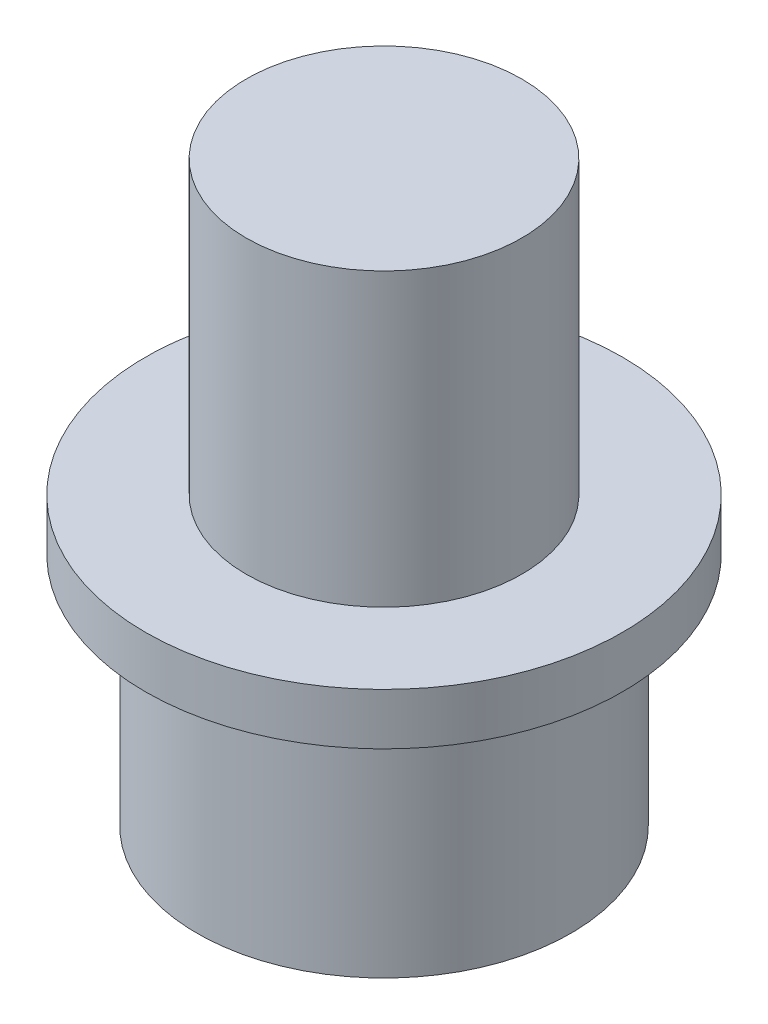
from build123d import *

# Parameters (mm, degrees)
SKETCH_2_R          = 2.3
CUT_EXTRUDE_1_DEPTH = 3.92
CUT_EXTRUDE_START   = -0.62
SKETCH_3_R          = 3.98
SKETCH_3_R_2        = 2.3
CUT_EXTRUDE_2_DEPTH = 0.62


with BuildPart() as part:
    # 草图1 → 旋转1 (revolve)
    with BuildSketch(Plane.XY, mode=Mode.PRIVATE) as revolve_1_sk:
        Polygon((0, 0), (0, 9.64), (2.3, 9.64), (2.3, 5.4), (3.98, 5.4), (3.98, 3.92), (3.12, 3.92), (3.12, 0), align=None)
    revolve(revolve_1_sk.sketch.rotate(Axis((0, 0, 0), (0, 1, 0)), 90), axis=Axis((0, 0, 0), (0, 1, 0)))

    # 草图2 → 切除-拉伸1 (cut)
    with BuildSketch(Plane.XZ):
        with Locations(Location((0, 0, 0), (0, 0, 270))):
            Circle(SKETCH_2_R)
    extrude(amount=-CUT_EXTRUDE_1_DEPTH, mode=Mode.SUBTRACT)

    # 草图3 → 切除-拉伸2 (cut)
    with BuildSketch(Plane(origin=(0, 5.4, 0), x_dir=(1, 0, 0), z_dir=(0, 1, 0)).offset(CUT_EXTRUDE_START)):
        with Locations(Location((0, 0, 0), (0, 0, 90))):
            Circle(SKETCH_3_R)
        with Locations(Location((0, 0, 0), (0, 0, 90))):
            Circle(SKETCH_3_R_2, mode=Mode.SUBTRACT)
    extrude(amount=CUT_EXTRUDE_2_DEPTH, mode=Mode.SUBTRACT)


solid = part.part
